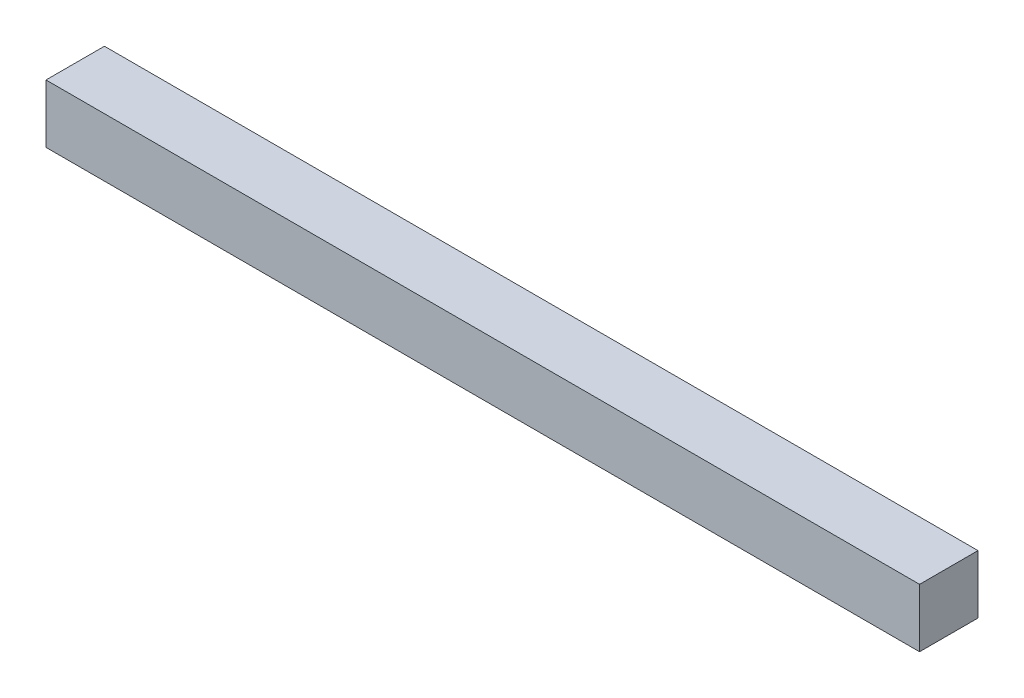
from build123d import *

# Parameters (mm, degrees)
SKETCH1_W           = 12.7
SKETCH1_H           = 12.7
BOSS_EXTRUDE1_DEPTH = 189.9


with BuildPart() as part:
    # Sketch1 → Boss-Extrude1 (new body)
    with BuildSketch(Plane.YZ):
        Rectangle(SKETCH1_W, SKETCH1_H)
    extrude(amount=BOSS_EXTRUDE1_DEPTH)


solid = part.part
